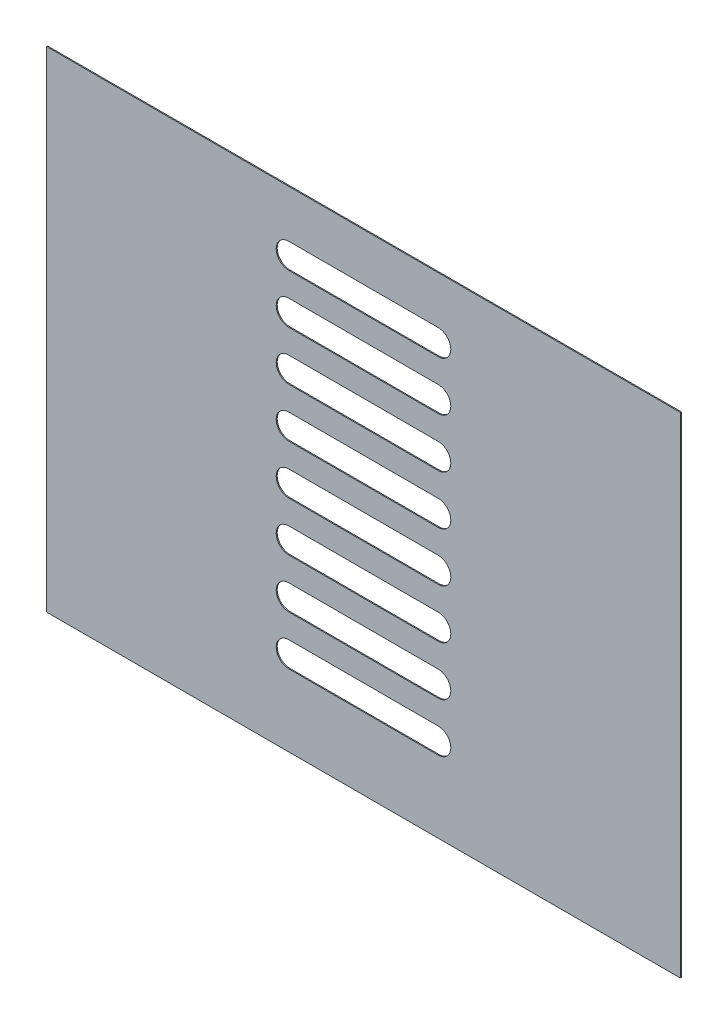
from build123d import *

# Parameters (mm, degrees)
SKETCH1_W           = 509
SKETCH1_H           = 393.5
BOSS_EXTRUDE1_DEPTH = 0.8


with BuildPart() as part:
    # Sketch1 → Boss-Extrude1 (new body)
    with BuildSketch(Plane.XY):
        with Locations((254.5, 196.75)):
            Rectangle(SKETCH1_W, SKETCH1_H)
        with BuildLine():
            ThreePointArc((314.5, 97.423934246), (324.620369271, 107.544303517), (314.5, 117.664672788))
            Line((314.5, 117.664672788), (194.5, 117.664672788))
            ThreePointArc((194.5, 117.664672788), (184.379630729, 107.544303517), (194.5, 97.423934246))
            Line((194.5, 97.423934246), (314.5, 97.423934246))
        make_face(mode=Mode.SUBTRACT)
        with BuildLine():
            ThreePointArc((314.5, 176.623934246), (324.620369271, 186.744303517), (314.5, 196.864672788))
            Line((314.5, 196.864672788), (194.5, 196.864672788))
            ThreePointArc((194.5, 196.864672788), (184.379630729, 186.744303517), (194.5, 176.623934246))
            Line((194.5, 176.623934246), (314.5, 176.623934246))
        make_face(mode=Mode.SUBTRACT)
        with BuildLine():
            ThreePointArc((314.5, 255.823934246), (324.620369271, 265.944303517), (314.5, 276.064672788))
            Line((314.5, 276.064672788), (194.5, 276.064672788))
            ThreePointArc((194.5, 276.064672788), (184.379630729, 265.944303517), (194.5, 255.823934246))
            Line((194.5, 255.823934246), (314.5, 255.823934246))
        make_face(mode=Mode.SUBTRACT)
        with BuildLine():
            ThreePointArc((314.5, 335.023934246), (324.620369271, 345.144303517), (314.5, 355.264672788))
            Line((314.5, 355.264672788), (194.5, 355.264672788))
            ThreePointArc((194.5, 355.264672788), (184.379630729, 345.144303517), (194.5, 335.023934246))
            Line((194.5, 335.023934246), (314.5, 335.023934246))
        make_face(mode=Mode.SUBTRACT)
        with BuildLine():
            Line((194.5, 315.666123662), (314.5, 315.666123662))
            ThreePointArc((314.5, 315.666123662), (324.620369271, 305.545754391), (314.5, 295.42538512))
            Line((314.5, 295.42538512), (194.5, 295.42538512))
            ThreePointArc((194.5, 295.42538512), (184.379630729, 305.545754391), (194.5, 315.666123662))
        make_face(mode=Mode.SUBTRACT)
        with BuildLine():
            Line((194.5, 236.466123662), (314.5, 236.466123662))
            ThreePointArc((314.5, 236.466123662), (324.620369271, 226.345754391), (314.5, 216.22538512))
            Line((314.5, 216.22538512), (194.5, 216.22538512))
            ThreePointArc((194.5, 216.22538512), (184.379630729, 226.345754391), (194.5, 236.466123662))
        make_face(mode=Mode.SUBTRACT)
        with BuildLine():
            Line((194.5, 157.266123662), (314.5, 157.266123662))
            ThreePointArc((314.5, 157.266123662), (324.620369271, 147.145754391), (314.5, 137.02538512))
            Line((314.5, 137.02538512), (194.5, 137.02538512))
            ThreePointArc((194.5, 137.02538512), (184.379630729, 147.145754391), (194.5, 157.266123662))
        make_face(mode=Mode.SUBTRACT)
        with BuildLine():
            Line((194.5, 78.066123662), (314.5, 78.066123662))
            ThreePointArc((314.5, 78.066123662), (324.620369271, 67.945754391), (314.5, 57.82538512))
            Line((314.5, 57.82538512), (194.5, 57.82538512))
            ThreePointArc((194.5, 57.82538512), (184.379630729, 67.945754391), (194.5, 78.066123662))
        make_face(mode=Mode.SUBTRACT)
    extrude(amount=BOSS_EXTRUDE1_DEPTH)


solid = part.part
